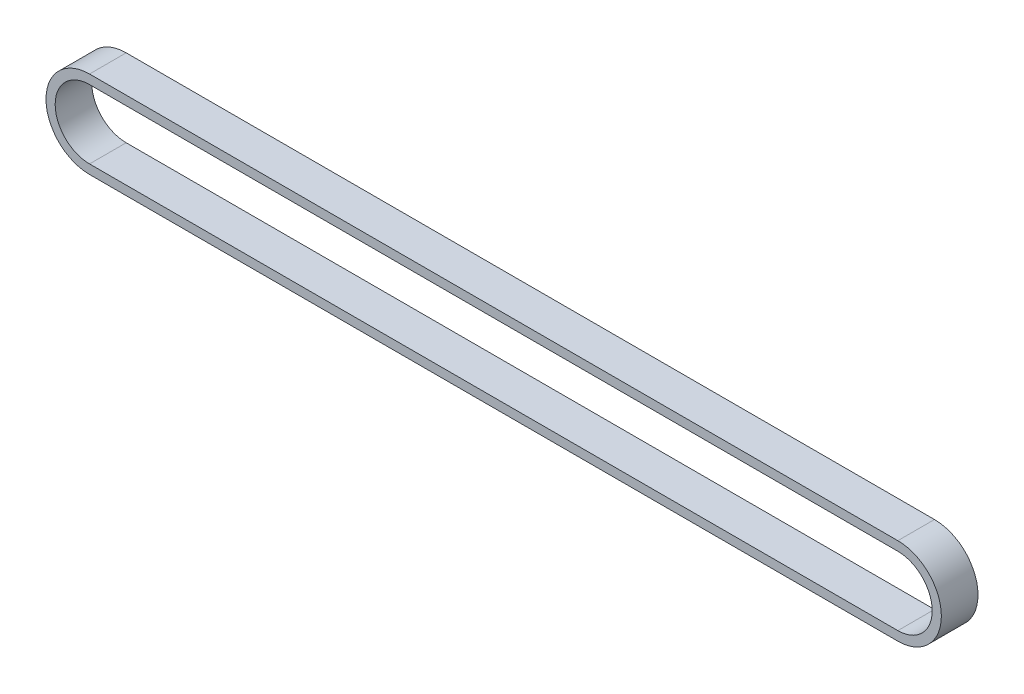
from build123d import *

# Parameters (mm, degrees)
BOSS_EXTRUDE1_DEPTH = 10.16


with BuildPart() as part:
    # Sketch1 → Boss-Extrude1 (new body)
    with BuildSketch(Plane.XY):
        with BuildLine():
            Line((-112.038165052, 12.065), (112.038165052, 12.065))
            ThreePointArc((112.038165052, 12.065), (124.103165052, 0), (112.038165052, -12.065))
            Line((112.038165052, -12.065), (-112.038165052, -12.065))
            ThreePointArc((-112.038165052, -12.065), (-124.103165052, 0), (-112.038165052, 12.065))
        make_face()
        with BuildLine():
            Line((-112.038165052, 9.525), (112.038165052, 9.525))
            ThreePointArc((112.038165052, 9.525), (121.563165052, 0), (112.038165052, -9.525))
            Line((112.038165052, -9.525), (-112.038165052, -9.525))
            ThreePointArc((-112.038165052, -9.525), (-121.563165052, 0), (-112.038165052, 9.525))
        make_face(mode=Mode.SUBTRACT)
    extrude(amount=BOSS_EXTRUDE1_DEPTH)


solid = part.part
